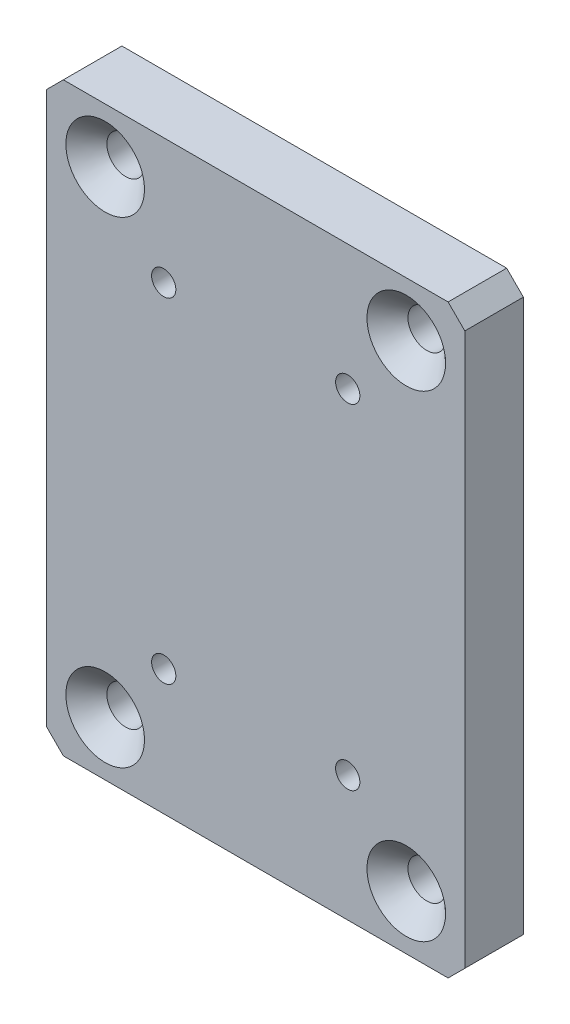
from build123d import *

# Parameters (mm, degrees)
SKETCH1_W                                            = 50
SKETCH1_H                                            = 70
SKETCH1_R                                            = 1.35
SKETCH1_R_2                                          = 1.5
BOSS_EXTRUDE1_DEPTH                                  = 7
CHAMFER1_SIZE                                        = 2
CHAMFER2_SIZE                                        = 2
CHAMFER3_SIZE                                        = 2
CHAMFER4_SIZE                                        = 2
CSK_FOR_M4_COUNTERSUNK_FLAT_HEAD_SCREW1_D            = 4.5
CSK_FOR_M4_COUNTERSUNK_FLAT_HEAD_SCREW1_DEPTH        = 7
CSK_FOR_M4_COUNTERSUNK_FLAT_HEAD_SCREW1_CSINK_D      = 9.4
CSK_FOR_M4_COUNTERSUNK_FLAT_HEAD_SCREW1_CSINK_ANGLE  = 90
CBORE_FOR_M2_5_HEX_SOCKET_HEAD_CAP_SCREW_D           = 2.9
CBORE_FOR_M2_5_HEX_SOCKET_HEAD_CAP_SCREW_CBORE_D     = 5.5
CBORE_FOR_M2_5_HEX_SOCKET_HEAD_CAP_SCREW_CBORE_DEPTH = 2.9


with BuildPart() as part:
    # Sketch1 → Boss-Extrude1 (new body)
    with BuildSketch(Plane.XY):
        Rectangle(SKETCH1_W, SKETCH1_H)
        with Locations(Location((11, 20, 0), (0, 0, 180))):
            Circle(SKETCH1_R, mode=Mode.SUBTRACT)
        with Locations(Location((-11, 20, 0), (0, 0, 180))):
            Circle(SKETCH1_R, mode=Mode.SUBTRACT)
        with Locations(Location((-11, -20, 0), (0, 0, 180))):
            Circle(SKETCH1_R, mode=Mode.SUBTRACT)
        with Locations(Location((11, -20, 0), (0, 0, 180))):
            Circle(SKETCH1_R, mode=Mode.SUBTRACT)
        with Locations(Location((18, 28.5, 0), (0, 0, 180))):
            Circle(SKETCH1_R_2, mode=Mode.SUBTRACT)
        with Locations(Location((-18, 28.5, 0), (0, 0, 180))):
            Circle(SKETCH1_R_2, mode=Mode.SUBTRACT)
        with Locations(Location((-18, -28.5, 0), (0, 0, 180))):
            Circle(SKETCH1_R_2, mode=Mode.SUBTRACT)
        with Locations(Location((18, -28.5, 0), (0, 0, 180))):
            Circle(SKETCH1_R_2, mode=Mode.SUBTRACT)
    extrude(amount=BOSS_EXTRUDE1_DEPTH)

    # Chamfer1
    chamfer1_edges = [part.edges().sort_by_distance(p)[0] for p in [
        (-25, 35, 3.5),
    ]]
    chamfer(chamfer1_edges, length=CHAMFER1_SIZE)

    # Chamfer2
    chamfer2_edges = [part.edges().sort_by_distance(p)[0] for p in [
        (-25, -35, 3.5),
    ]]
    chamfer(chamfer2_edges, length=CHAMFER2_SIZE)

    # Chamfer3
    chamfer3_edges = [part.edges().sort_by_distance(p)[0] for p in [
        (25, -35, 3.5),
    ]]
    chamfer(chamfer3_edges, length=CHAMFER3_SIZE)

    # Chamfer4
    chamfer4_edges = [part.edges().sort_by_distance(p)[0] for p in [
        (25, 35, 3.5),
    ]]
    chamfer(chamfer4_edges, length=CHAMFER4_SIZE)

    # CSK for M4 Countersunk Flat Head Screw1
    with Locations(Plane.XY.offset(7)):
        with Locations((18, 28.5), (18, -28.5), (-18, -28.5), (-18, 28.5)):
            CounterSinkHole(CSK_FOR_M4_COUNTERSUNK_FLAT_HEAD_SCREW1_D / 2, CSK_FOR_M4_COUNTERSUNK_FLAT_HEAD_SCREW1_CSINK_D / 2, depth=CSK_FOR_M4_COUNTERSUNK_FLAT_HEAD_SCREW1_DEPTH, counter_sink_angle=CSK_FOR_M4_COUNTERSUNK_FLAT_HEAD_SCREW1_CSINK_ANGLE)

    # CBORE for M2.5 Hex Socket Head Cap Screw1 (through all)
    with Locations(Plane(origin=(0, 0, 0), x_dir=(-1, 0, 0), z_dir=(0, 0, -1))):
        with Locations((11, 20), (-11, 20), (-11, -20), (11, -20)):
            CounterBoreHole(CBORE_FOR_M2_5_HEX_SOCKET_HEAD_CAP_SCREW_D / 2, CBORE_FOR_M2_5_HEX_SOCKET_HEAD_CAP_SCREW_CBORE_D / 2, CBORE_FOR_M2_5_HEX_SOCKET_HEAD_CAP_SCREW_CBORE_DEPTH)


solid = part.part
